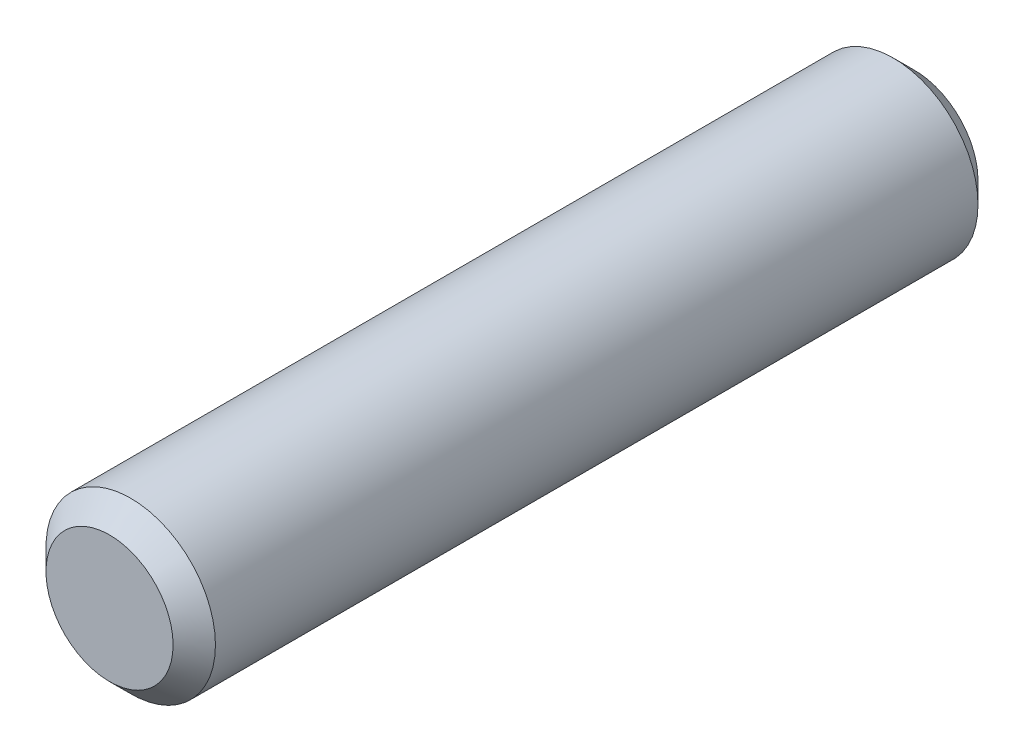
from build123d import *

# Parameters (mm, degrees)
SKETCH1_R           = 2
BOSS_EXTRUDE1_DEPTH = 19
CHAMFER1_SIZE       = 0.5


with BuildPart() as part:
    # Sketch1 → Boss-Extrude1 (new body)
    with BuildSketch(Plane.XY):
        Circle(SKETCH1_R)
    extrude(amount=BOSS_EXTRUDE1_DEPTH)

    # Chamfer1
    chamfer1_edges = [part.edges().sort_by_distance(p)[0] for p in [
        (-2, 0, 0),
        (-2, 0, 19),
    ]]
    chamfer(chamfer1_edges, length=CHAMFER1_SIZE)


solid = part.part
